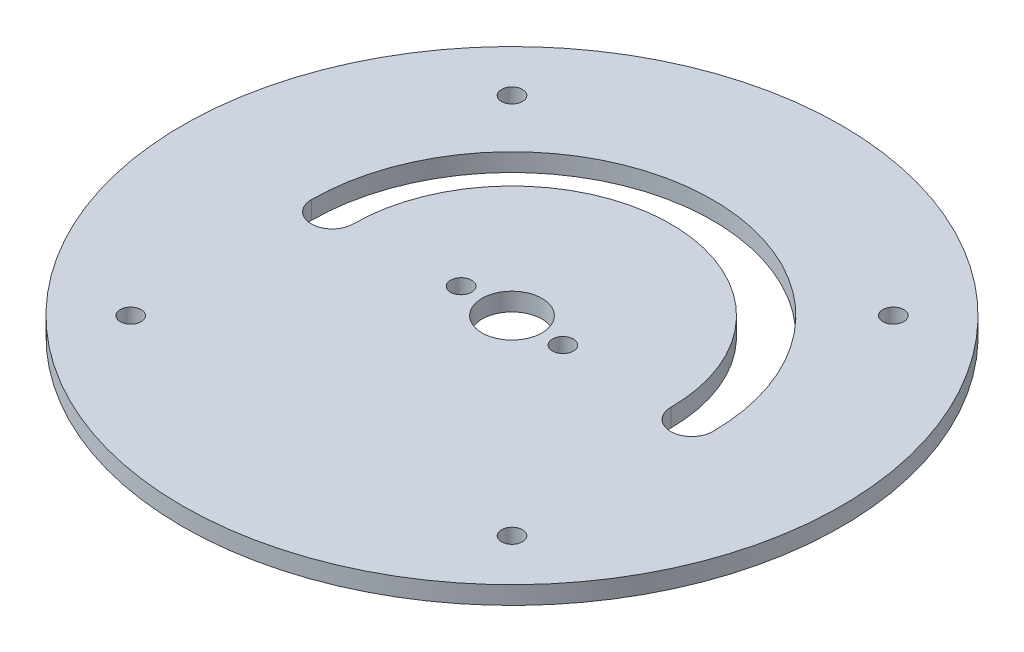
from build123d import *

# Parameters (mm, degrees)
SKETCH1_R           = 55
SKETCH1_R_2         = 5
SKETCH1_R_3         = 1.75
BOSS_EXTRUDE1_DEPTH = 3


with BuildPart() as part:
    # Sketch1 → Boss-Extrude1 (new body)
    with BuildSketch(Plane(origin=(0, 0, 0), x_dir=(1, 0, 0), z_dir=(0, 1, 0))):
        with Locations(Location((0, 0, 0), (0, 0, 270))):
            Circle(SKETCH1_R)
        with Locations(Location((0, 0, 0), (0, 0, 270))):
            Circle(SKETCH1_R_2, mode=Mode.SUBTRACT)
        with Locations(Location((8.5, 0, 0), (0, 0, 270))):
            Circle(SKETCH1_R_3, mode=Mode.SUBTRACT)
        with Locations(Location((-8.5, 0, 0), (0, 0, 90))):
            Circle(SKETCH1_R_3, mode=Mode.SUBTRACT)
        with Locations(Location((-31.819805153, 31.819805153, 0), (0, 0, 270))):
            Circle(SKETCH1_R_3, mode=Mode.SUBTRACT)
        with Locations(Location((31.819805153, 31.819805153, 0), (0, 0, 270))):
            Circle(SKETCH1_R_3, mode=Mode.SUBTRACT)
        with Locations(Location((31.819805153, -31.819805153, 0), (0, 0, 270))):
            Circle(SKETCH1_R_3, mode=Mode.SUBTRACT)
        with Locations(Location((-31.819805153, -31.819805153, 0), (0, 0, 270))):
            Circle(SKETCH1_R_3, mode=Mode.SUBTRACT)
        with BuildLine():
            ThreePointArc((33.5, 0), (0, 33.5), (-33.5, 0))
            ThreePointArc((-33.5, 0), (-30, -3.5), (-26.5, 0))
            ThreePointArc((-26.5, 0), (0, 26.5), (26.5, 0))
            ThreePointArc((26.5, 0), (30, -3.5), (33.5, 0))
        make_face(mode=Mode.SUBTRACT)
    extrude(amount=BOSS_EXTRUDE1_DEPTH)


solid = part.part
